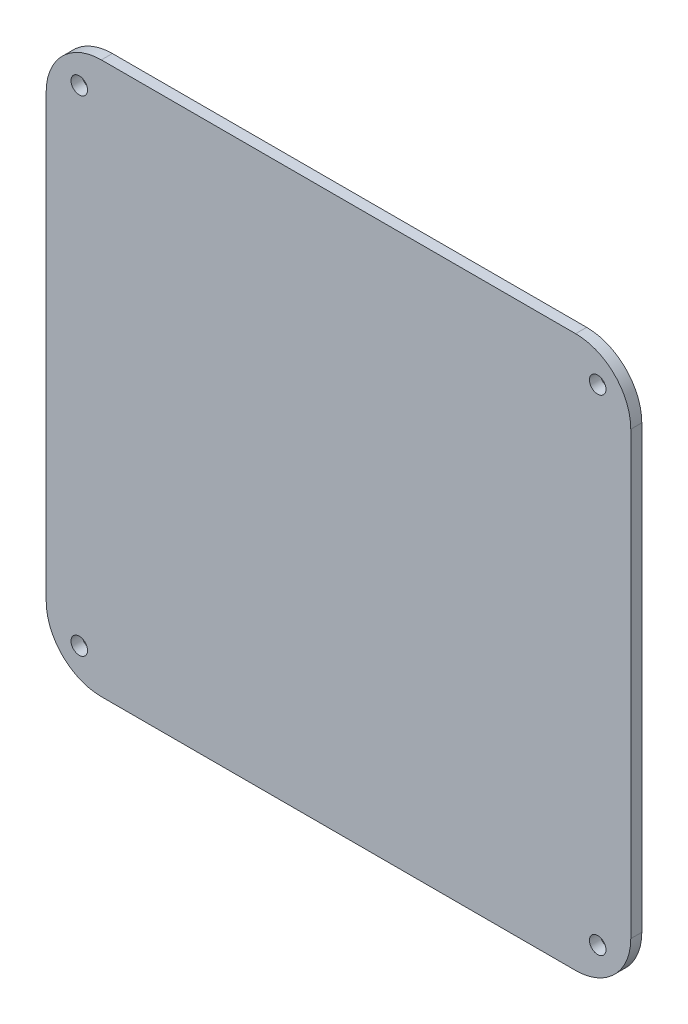
from build123d import *

# Parameters (mm, degrees)
BOSS_EXTRUDE1_DEPTH = 2
SKETCH2_R           = 1.5
CUT_EXTRUDE1_DEPTH  = 3


with BuildPart() as part:
    # Sketch1 → Boss-Extrude1 (new body)
    with BuildSketch(Plane.XY):
        with BuildLine():
            Line((-43, 260), (43, 260))
            ThreePointArc((43, 260), (50.071067812, 262.928932188), (53, 270))
            Line((53, 270), (53, 350))
            ThreePointArc((53, 350), (50.071067812, 357.071067812), (43, 360))
            Line((43, 360), (-43, 360))
            ThreePointArc((-43, 360), (-50.071067812, 357.071067812), (-53, 350))
            Line((-53, 350), (-53, 270))
            ThreePointArc((-53, 270), (-50.071067812, 262.928932188), (-43, 260))
        make_face()
    extrude(amount=-BOSS_EXTRUDE1_DEPTH)

    # Sketch2 → Cut-Extrude1 (cut)
    with BuildSketch(Plane(origin=(0, 0, -2), x_dir=(-1, 0, 0), z_dir=(0, 0, -1))):
        with Locations((47, 266)):
            Circle(SKETCH2_R)
        with Locations((47, 354)):
            Circle(SKETCH2_R)
        with Locations((-47, 354)):
            Circle(SKETCH2_R)
        with Locations((-47, 266)):
            Circle(SKETCH2_R)
    extrude(amount=-CUT_EXTRUDE1_DEPTH, mode=Mode.SUBTRACT)


solid = part.part
